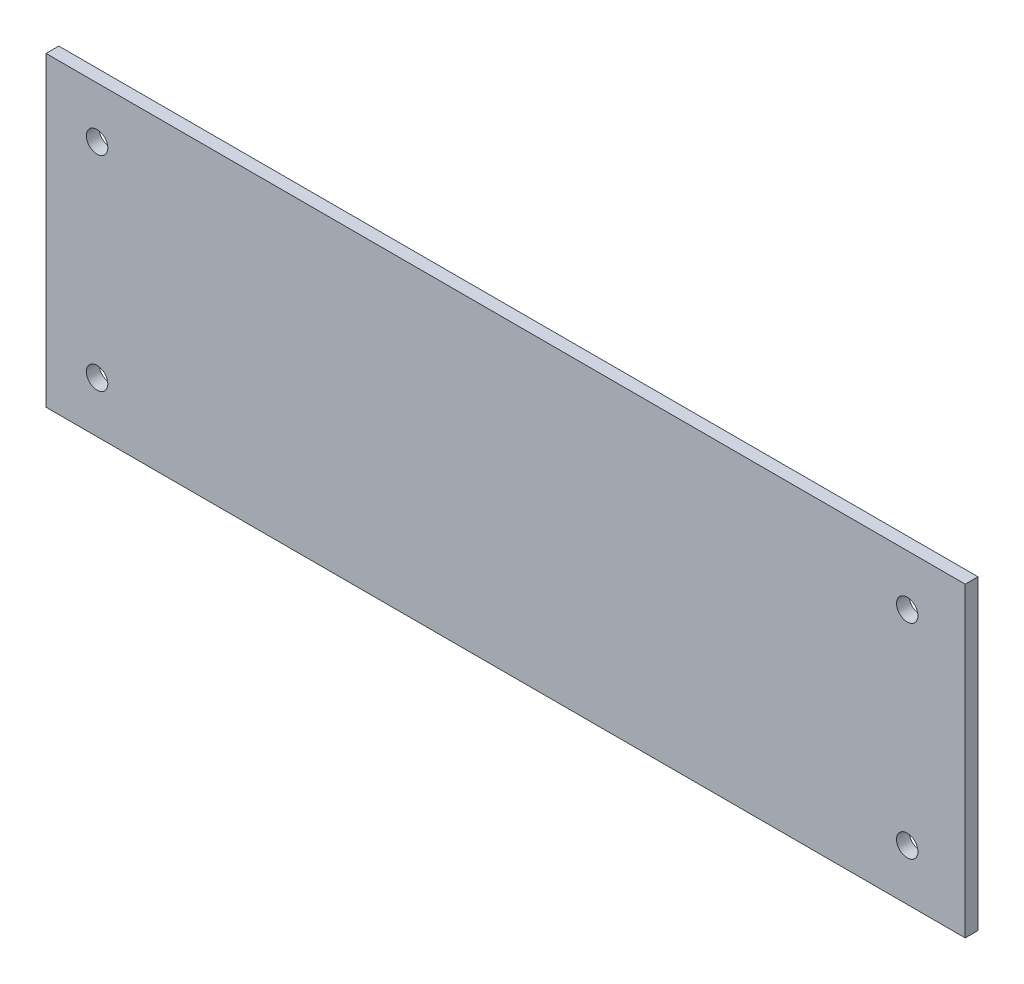
from build123d import *

# Parameters (mm, degrees)
SKETCH1_W           = 228.6
SKETCH1_H           = 76.2
BOSS_EXTRUDE1_DEPTH = 3.175
SKETCH3_R           = 2.667
CUT_EXTRUDE2_DEPTH  = 3.175


with BuildPart() as part:
    # Sketch1 → Boss-Extrude1 (new body)
    with BuildSketch(Plane.XY):
        Rectangle(SKETCH1_W, SKETCH1_H)
    extrude(amount=BOSS_EXTRUDE1_DEPTH)

    # Sketch3 → Cut-Extrude2 (cut)
    with BuildSketch(Plane.XY.offset(3.175)):
        with Locations((-101.6, 25.4)):
            Circle(SKETCH3_R)
        with Locations(Location((-101.6, -25.4, 0), (0, 0, 180))):
            Circle(SKETCH3_R)
        with Locations((99.872641584, -25.4)):
            Circle(SKETCH3_R)
        with Locations(Location((99.872641584, 25.4, 0), (0, 0, 180))):
            Circle(SKETCH3_R)
    extrude(amount=-CUT_EXTRUDE2_DEPTH, mode=Mode.SUBTRACT)


solid = part.part
